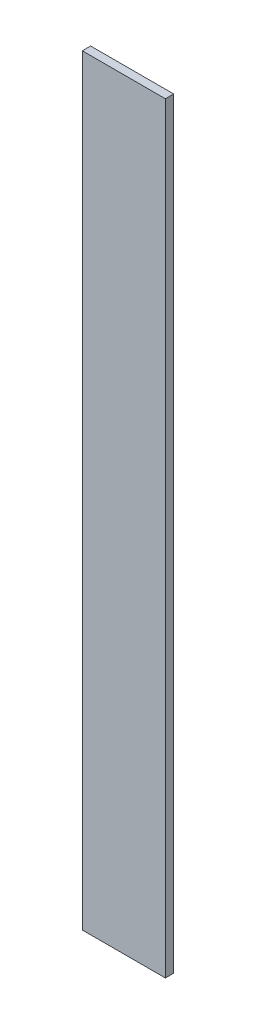
from build123d import *

# Parameters (mm, degrees)
SKETCH1_W           = 275
SKETCH1_H           = 30
BOSS_EXTRUDE1_DEPTH = 3


with BuildPart() as part:
    # Sketch1 → Boss-Extrude1 (new body)
    with BuildSketch(Plane(origin=(0, 0, 0), x_dir=(0, 1, 0), z_dir=(0, 0, 1))):
        Rectangle(SKETCH1_W, SKETCH1_H)
    extrude(amount=BOSS_EXTRUDE1_DEPTH)


solid = part.part
